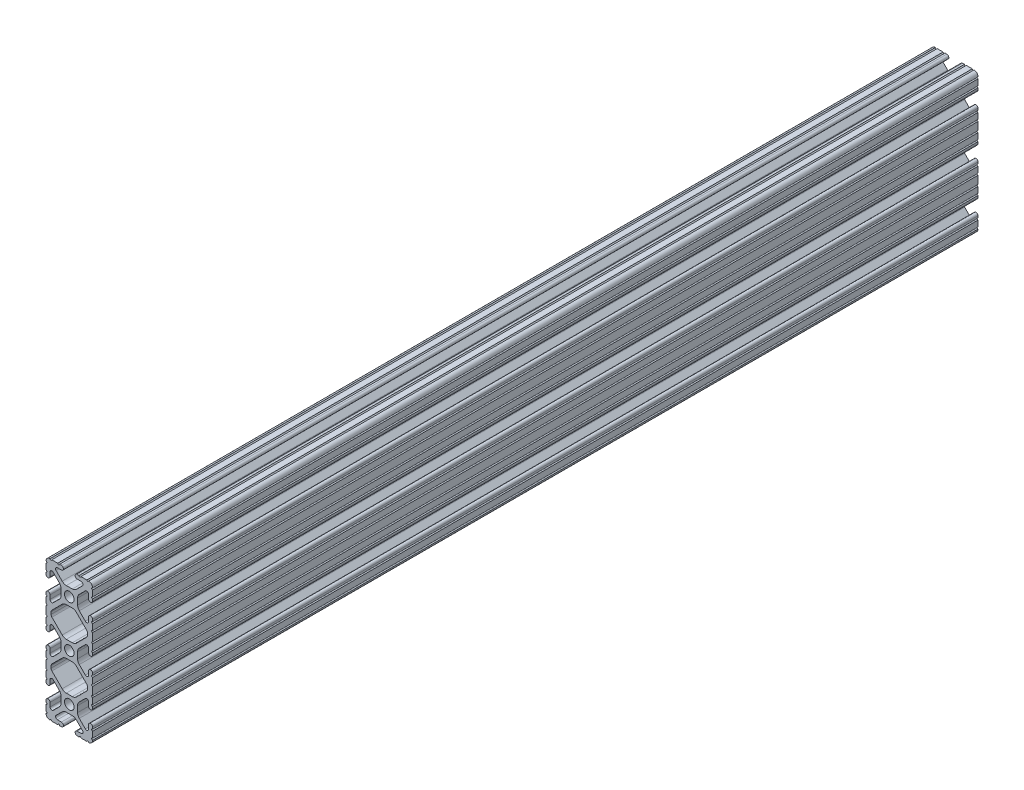
from build123d import *

# Parameters (mm, degrees)
SKETCH1_R           = 2.6035
BOSS_EXTRUDE1_DEPTH = 241.3


with BuildPart() as part:
    # Sketch1 → Boss-Extrude1 (new, symmetric)
    with BuildSketch(Plane.XY):
        with BuildLine():
            Line((-12.7, 34.9504), (-12.7, 31.7246))
            ThreePointArc((-12.7, 31.7246), (-12.192, 31.2166), (-12.7, 30.7086))
            Line((-12.7, 30.7086), (-12.7, 29.702307889))
            ThreePointArc((-12.7, 29.702307889), (-11.5951, 28.597407889), (-10.4902, 29.702307889))
            Line((-10.4902, 29.702307889), (-10.4902, 31.874794456))
            ThreePointArc((-10.4902, 31.874794456), (-9.863006367, 32.813456061), (-8.75577951, 32.593214945))
            Line((-8.75577951, 32.593214945), (-5.43843597, 29.275871405))
            ThreePointArc((-5.43843597, 29.275871405), (-4.750182484, 28.245827272), (-4.5085, 27.030807374))
            Line((-4.5085, 27.030807374), (-4.5085, 23.769192626))
            ThreePointArc((-4.5085, 23.769192626), (-4.750182484, 22.554172728), (-5.43843597, 21.524128595))
            Line((-5.43843597, 21.524128595), (-8.75577951, 18.206785055))
            ThreePointArc((-8.75577951, 18.206785055), (-9.863006367, 17.986543939), (-10.4902, 18.925205544))
            Line((-10.4902, 18.925205544), (-10.4902, 21.097692111))
            ThreePointArc((-10.4902, 21.097692111), (-11.5951, 22.202592111), (-12.7, 21.097692111))
            Line((-12.7, 21.097692111), (-12.7, 20.0914))
            ThreePointArc((-12.7, 20.0914), (-12.192, 19.5834), (-12.7, 19.0754))
            Line((-12.7, 19.0754), (-12.7, 15.8496))
            ThreePointArc((-12.7, 15.8496), (-12.192, 15.3416), (-12.7, 14.8336))
            Line((-12.7, 14.8336), (-12.7, 10.5664))
            ThreePointArc((-12.7, 10.5664), (-12.192, 10.0584), (-12.7, 9.5504))
            Line((-12.7, 9.5504), (-12.7, 6.3246))
            ThreePointArc((-12.7, 6.3246), (-12.192000017, 5.8166), (-12.7, 5.3086))
            Line((-12.7, 5.3086), (-12.7, 4.302307889))
            ThreePointArc((-12.7, 4.302307889), (-11.5951, 3.197407889), (-10.4902, 4.302307889))
            Line((-10.4902, 4.302307889), (-10.4902, 6.474794456))
            ThreePointArc((-10.4902, 6.474794456), (-9.863006367, 7.413456061), (-8.75577951, 7.193214945))
            Line((-8.75577951, 7.193214945), (-5.43843597, 3.875871405))
            ThreePointArc((-5.43843597, 3.875871405), (-4.750182484, 2.845827272), (-4.5085, 1.630807374))
            Line((-4.5085, 1.630807374), (-4.5085, -1.630807374))
            ThreePointArc((-4.5085, -1.630807374), (-4.750182484, -2.845827272), (-5.43843597, -3.875871405))
            Line((-5.43843597, -3.875871405), (-8.75577951, -7.193214945))
            ThreePointArc((-8.75577951, -7.193214945), (-9.863006367, -7.413456061), (-10.4902, -6.474794456))
            Line((-10.4902, -6.474794456), (-10.4902, -4.302307889))
            ThreePointArc((-10.4902, -4.302307889), (-11.5951, -3.197407889), (-12.7, -4.302307889))
            Line((-12.7, -4.302307889), (-12.7, -5.3086))
            ThreePointArc((-12.7, -5.3086), (-12.191999983, -5.8166), (-12.7, -6.3246))
            Line((-12.7, -6.3246), (-12.7, -9.5504))
            ThreePointArc((-12.7, -9.5504), (-12.192, -10.0584), (-12.7, -10.5664))
            Line((-12.7, -10.5664), (-12.7, -14.8336))
            ThreePointArc((-12.7, -14.8336), (-12.192, -15.3416), (-12.7, -15.8496))
            Line((-12.7, -15.8496), (-12.7, -19.0754))
            ThreePointArc((-12.7, -19.0754), (-12.192, -19.5834), (-12.7, -20.0914))
            Line((-12.7, -20.0914), (-12.7, -21.097692111))
            ThreePointArc((-12.7, -21.097692111), (-11.5951, -22.202592111), (-10.4902, -21.097692111))
            Line((-10.4902, -21.097692111), (-10.4902, -18.925205544))
            ThreePointArc((-10.4902, -18.925205544), (-9.863006367, -17.986543939), (-8.75577951, -18.206785055))
            Line((-8.75577951, -18.206785055), (-5.43843597, -21.524128595))
            ThreePointArc((-5.43843597, -21.524128595), (-4.750182484, -22.554172728), (-4.5085, -23.769192626))
            Line((-4.5085, -23.769192626), (-4.5085, -27.030807374))
            ThreePointArc((-4.5085, -27.030807374), (-4.750182484, -28.245827272), (-5.43843597, -29.275871405))
            Line((-5.43843597, -29.275871405), (-8.75577951, -32.593214945))
            ThreePointArc((-8.75577951, -32.593214945), (-9.863006367, -32.813456061), (-10.4902, -31.874794456))
            Line((-10.4902, -31.874794456), (-10.4902, -29.702307889))
            ThreePointArc((-10.4902, -29.702307889), (-11.5951, -28.597407889), (-12.7, -29.702307889))
            Line((-12.7, -29.702307889), (-12.7, -30.7086))
            ThreePointArc((-12.7, -30.7086), (-12.192, -31.2166), (-12.7, -31.7246))
            Line((-12.7, -31.7246), (-12.7, -34.9504))
            ThreePointArc((-12.7, -34.9504), (-12.192, -35.4584), (-12.7, -35.9664))
            ThreePointArc((-12.7, -35.9664), (-12.082677406, -37.482677406), (-10.5664, -38.1))
            ThreePointArc((-10.5664, -38.1), (-10.0584, -37.592), (-9.5504, -38.1))
            Line((-9.5504, -38.1), (-6.3246, -38.1))
            ThreePointArc((-6.3246, -38.1), (-5.816599996, -37.592000017), (-5.3086, -38.100000008))
            Line((-5.3086, -38.100000008), (-4.302307889, -38.100000008))
            ThreePointArc((-4.302307889, -38.100000008), (-3.197407889, -36.995100008), (-4.302307889, -35.890200008))
            Line((-4.302307889, -35.890200008), (-6.474794456, -35.890200008))
            ThreePointArc((-6.474794456, -35.890200008), (-7.413456061, -35.263006376), (-7.193214945, -34.155779519))
            Line((-7.193214945, -34.155779519), (-3.875871405, -30.838435978))
            ThreePointArc((-3.875871405, -30.838435978), (-2.845827272, -30.150182493), (-1.630807374, -29.908500008))
            Line((-1.630807374, -29.908500008), (1.630807374, -29.908500008))
            ThreePointArc((1.630807374, -29.908500008), (2.845827272, -30.150182493), (3.875871405, -30.838435978))
            Line((3.875871405, -30.838435978), (7.193214945, -34.155779519))
            ThreePointArc((7.193214945, -34.155779519), (7.413456061, -35.263006376), (6.474794456, -35.890200008))
            Line((6.474794456, -35.890200008), (4.302307889, -35.890200008))
            ThreePointArc((4.302307889, -35.890200008), (3.197407889, -36.995100008), (4.302307889, -38.100000008))
            Line((4.302307889, -38.100000008), (5.3086, -38.100000008))
            ThreePointArc((5.3086, -38.100000008), (5.8166, -37.591999992), (6.3246, -38.100000008))
            Line((6.3246, -38.100000008), (9.5504, -38.100000008))
            ThreePointArc((9.5504, -38.100000008), (10.0584, -37.592000008), (10.5664, -38.100000008))
            ThreePointArc((10.5664, -38.100000008), (12.082677406, -37.482677414), (12.7, -35.966400008))
            ThreePointArc((12.7, -35.966400008), (12.192, -35.458400008), (12.7, -34.950400008))
            Line((12.7, -34.950400008), (12.7, -31.724600008))
            ThreePointArc((12.7, -31.724600008), (12.192, -31.216600008), (12.7, -30.708600008))
            Line((12.7, -30.708600008), (12.7, -29.702307926))
            ThreePointArc((12.7, -29.702307926), (11.5951, -28.597407926), (10.4902, -29.702307926))
            Line((10.4902, -29.702307926), (10.4902, -31.874794464))
            ThreePointArc((10.4902, -31.874794464), (9.863006367, -32.813456069), (8.75577951, -32.593214954))
            Line((8.75577951, -32.593214954), (5.43843597, -29.275871413))
            ThreePointArc((5.43843597, -29.275871413), (4.750182484, -28.245827281), (4.5085, -27.030807383))
            Line((4.5085, -27.030807383), (4.5085, -23.769192634))
            ThreePointArc((4.5085, -23.769192634), (4.750182484, -22.554172736), (5.43843597, -21.524128604))
            Line((5.43843597, -21.524128604), (8.75577951, -18.206785063))
            ThreePointArc((8.75577951, -18.206785063), (9.863006367, -17.986543948), (10.4902, -18.925205553))
            Line((10.4902, -18.925205553), (10.4902, -21.097692067))
            ThreePointArc((10.4902, -21.097692067), (11.5951, -22.202592067), (12.7, -21.097692067))
            Line((12.7, -21.097692067), (12.7, -20.091400008))
            ThreePointArc((12.7, -20.091400008), (12.192, -19.583400008), (12.7, -19.075400008))
            Line((12.7, -19.075400008), (12.7, -15.849600008))
            ThreePointArc((12.7, -15.849600008), (12.192, -15.341600008), (12.7, -14.833600008))
            Line((12.7, -14.833600008), (12.7, -10.566400008))
            ThreePointArc((12.7, -10.566400008), (12.192, -10.058400008), (12.7, -9.550400008))
            Line((12.7, -9.550400008), (12.7, -6.324600008))
            ThreePointArc((12.7, -6.324600008), (12.192000017, -5.816600008), (12.7, -5.308600008))
            Line((12.7, -5.308600008), (12.7, -4.302307897))
            ThreePointArc((12.7, -4.302307897), (11.5951, -3.197407897), (10.4902, -4.302307897))
            Line((10.4902, -4.302307897), (10.4902, -6.474794464))
            ThreePointArc((10.4902, -6.474794464), (9.863006367, -7.413456069), (8.75577951, -7.193214954))
            Line((8.75577951, -7.193214954), (5.43843597, -3.875871413))
            ThreePointArc((5.43843597, -3.875871413), (4.750182484, -2.845827281), (4.5085, -1.630807383))
            Line((4.5085, -1.630807383), (4.5085, 1.630807366))
            ThreePointArc((4.5085, 1.630807366), (4.750182484, 2.845827264), (5.43843597, 3.875871396))
            Line((5.43843597, 3.875871396), (8.75577951, 7.193214937))
            ThreePointArc((8.75577951, 7.193214937), (9.863006367, 7.413456052), (10.4902, 6.474794447))
            Line((10.4902, 6.474794447), (10.4902, 4.302307881))
            ThreePointArc((10.4902, 4.302307881), (11.5951, 3.197407881), (12.7, 4.302307881))
            Line((12.7, 4.302307881), (12.7, 5.308599992))
            ThreePointArc((12.7, 5.308599992), (12.191999983, 5.816599992), (12.7, 6.324599992))
            Line((12.7, 6.324599992), (12.7, 9.550399992))
            ThreePointArc((12.7, 9.550399992), (12.192, 10.058399992), (12.7, 10.566399992))
            Line((12.7, 10.566399992), (12.7, 14.833599992))
            ThreePointArc((12.7, 14.833599992), (12.192, 15.341599992), (12.7, 15.849599992))
            Line((12.7, 15.849599992), (12.7, 19.075399992))
            ThreePointArc((12.7, 19.075399992), (12.192, 19.583399992), (12.7, 20.091399992))
            Line((12.7, 20.091399992), (12.7, 21.097692074))
            ThreePointArc((12.7, 21.097692074), (11.5951, 22.202592074), (10.4902, 21.097692074))
            Line((10.4902, 21.097692074), (10.4902, 18.925205536))
            ThreePointArc((10.4902, 18.925205536), (9.863006367, 17.986543931), (8.75577951, 18.206785046))
            Line((8.75577951, 18.206785046), (5.43843597, 21.524128587))
            ThreePointArc((5.43843597, 21.524128587), (4.750182484, 22.554172719), (4.5085, 23.769192617))
            Line((4.5085, 23.769192617), (4.5085, 27.030807366))
            ThreePointArc((4.5085, 27.030807366), (4.750182484, 28.245827264), (5.43843597, 29.275871396))
            Line((5.43843597, 29.275871396), (8.75577951, 32.593214937))
            ThreePointArc((8.75577951, 32.593214937), (9.863006367, 32.813456052), (10.4902, 31.874794447))
            Line((10.4902, 31.874794447), (10.4902, 29.702307881))
            ThreePointArc((10.4902, 29.702307881), (11.5951, 28.597407881), (12.7, 29.702307881))
            Line((12.7, 29.702307881), (12.7, 30.708599992))
            ThreePointArc((12.7, 30.708599992), (12.192, 31.216599992), (12.7, 31.724599992))
            Line((12.7, 31.724599992), (12.7, 34.9504))
            ThreePointArc((12.7, 34.9504), (12.192, 35.4584), (12.7, 35.9664))
            ThreePointArc((12.7, 35.9664), (12.082677406, 37.482677406), (10.5664, 38.1))
            ThreePointArc((10.5664, 38.1), (10.0584, 37.592), (9.5504, 38.1))
            Line((9.5504, 38.1), (6.3246, 38.1))
            ThreePointArc((6.3246, 38.1), (5.8166, 37.591999983), (5.3086, 38.1))
            Line((5.3086, 38.1), (4.302307889, 38.1))
            ThreePointArc((4.302307889, 38.1), (3.197407889, 36.9951), (4.302307889, 35.8902))
            Line((4.302307889, 35.8902), (6.474794456, 35.8902))
            ThreePointArc((6.474794456, 35.8902), (7.413456061, 35.263006367), (7.193214945, 34.15577951))
            Line((7.193214945, 34.15577951), (3.875871405, 30.83843597))
            ThreePointArc((3.875871405, 30.83843597), (2.845827272, 30.150182484), (1.630807374, 29.9085))
            Line((1.630807374, 29.9085), (-1.630807374, 29.9085))
            ThreePointArc((-1.630807374, 29.9085), (-2.845827272, 30.150182484), (-3.875871405, 30.83843597))
            Line((-3.875871405, 30.83843597), (-7.193214945, 34.15577951))
            ThreePointArc((-7.193214945, 34.15577951), (-7.413456061, 35.263006367), (-6.474794456, 35.8902))
            Line((-6.474794456, 35.8902), (-4.302307889, 35.8902))
            ThreePointArc((-4.302307889, 35.8902), (-3.197407889, 36.9951), (-4.302307889, 38.1))
            Line((-4.302307889, 38.1), (-5.3086, 38.1))
            ThreePointArc((-5.3086, 38.1), (-5.8166, 37.592000017), (-6.3246, 38.1))
            Line((-6.3246, 38.1), (-9.5504, 38.1))
            ThreePointArc((-9.5504, 38.1), (-10.0584, 37.592), (-10.5664, 38.1))
            ThreePointArc((-10.5664, 38.1), (-12.082677406, 37.482677406), (-12.7, 35.9664))
            ThreePointArc((-12.7, 35.9664), (-12.192, 35.4584), (-12.7, 34.9504))
        make_face()
        with Locations(Location((0, -25.4, 0), (0, 0, 180))):
            Circle(SKETCH1_R, mode=Mode.SUBTRACT)
        with Locations(Location((0, 0, 0), (0, 0, 180))):
            Circle(SKETCH1_R, mode=Mode.SUBTRACT)
        with Locations(Location((0, 25.4, 0), (0, 0, 180))):
            Circle(SKETCH1_R, mode=Mode.SUBTRACT)
        with BuildLine():
            Line((-9.9314, -12.146268083), (-9.9314, -13.253731917))
            ThreePointArc((-9.9314, -13.253731917), (-9.811525488, -13.856381786), (-9.470151759, -14.367283676))
            Line((-9.470151759, -14.367283676), (-3.875871405, -19.96156403))
            ThreePointArc((-3.875871405, -19.96156403), (-2.845827272, -20.649817516), (-1.630807374, -20.8915))
            Line((-1.630807374, -20.8915), (1.630807374, -20.8915))
            ThreePointArc((1.630807374, -20.8915), (2.845827272, -20.649817516), (3.875871405, -19.96156403))
            Line((3.875871405, -19.96156403), (9.470151759, -14.367283676))
            ThreePointArc((9.470151759, -14.367283676), (9.811525488, -13.856381786), (9.9314, -13.253731917))
            Line((9.9314, -13.253731917), (9.9314, -12.146268083))
            ThreePointArc((9.9314, -12.146268083), (9.811525488, -11.543618214), (9.470151759, -11.032716324))
            Line((9.470151759, -11.032716324), (3.875871405, -5.43843597))
            ThreePointArc((3.875871405, -5.43843597), (2.845827272, -4.750182484), (1.630807374, -4.5085))
            Line((1.630807374, -4.5085), (-1.630807374, -4.5085))
            ThreePointArc((-1.630807374, -4.5085), (-2.845827272, -4.750182484), (-3.875871405, -5.43843597))
            Line((-3.875871405, -5.43843597), (-9.470151759, -11.032716324))
            ThreePointArc((-9.470151759, -11.032716324), (-9.811525488, -11.543618214), (-9.9314, -12.146268083))
        make_face(mode=Mode.SUBTRACT)
        with BuildLine():
            Line((-9.9314, 13.253731917), (-9.9314, 12.146268083))
            ThreePointArc((-9.9314, 12.146268083), (-9.811525488, 11.543618214), (-9.470151759, 11.032716324))
            Line((-9.470151759, 11.032716324), (-3.875871405, 5.43843597))
            ThreePointArc((-3.875871405, 5.43843597), (-2.845827272, 4.750182484), (-1.630807374, 4.5085))
            Line((-1.630807374, 4.5085), (1.630807374, 4.5085))
            ThreePointArc((1.630807374, 4.5085), (2.845827272, 4.750182484), (3.875871405, 5.43843597))
            Line((3.875871405, 5.43843597), (9.470151759, 11.032716324))
            ThreePointArc((9.470151759, 11.032716324), (9.811525488, 11.543618214), (9.9314, 12.146268083))
            Line((9.9314, 12.146268083), (9.9314, 13.253731917))
            ThreePointArc((9.9314, 13.253731917), (9.811525488, 13.856381786), (9.470151759, 14.367283676))
            Line((9.470151759, 14.367283676), (3.875871405, 19.96156403))
            ThreePointArc((3.875871405, 19.96156403), (2.845827272, 20.649817516), (1.630807374, 20.8915))
            Line((1.630807374, 20.8915), (-1.630807374, 20.8915))
            ThreePointArc((-1.630807374, 20.8915), (-2.845827272, 20.649817516), (-3.875871405, 19.96156403))
            Line((-3.875871405, 19.96156403), (-9.470151759, 14.367283676))
            ThreePointArc((-9.470151759, 14.367283676), (-9.811525488, 13.856381786), (-9.9314, 13.253731917))
        make_face(mode=Mode.SUBTRACT)
    extrude(amount=BOSS_EXTRUDE1_DEPTH, both=True)


solid = part.part
